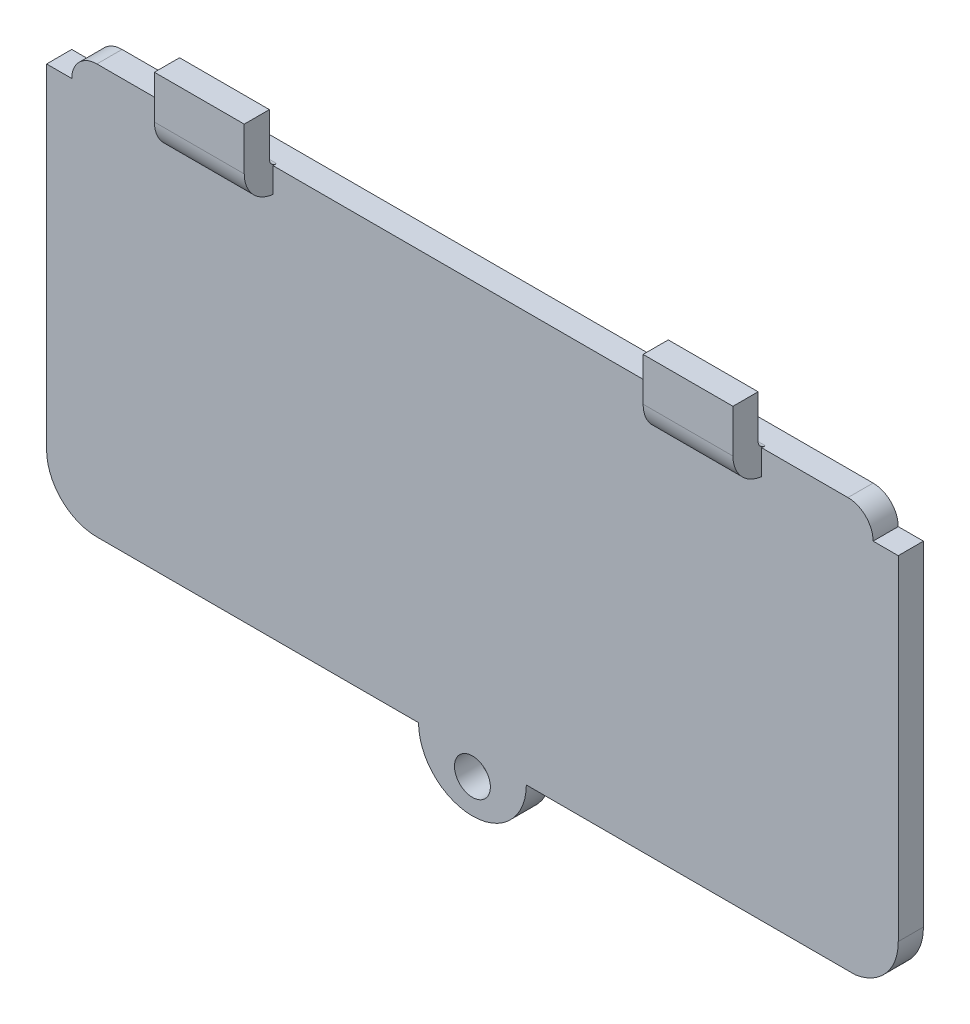
from build123d import *

# Parameters (mm, degrees)
BOSS_EXTRUDE1_DEPTH = 1.778
SKETCH3_R           = 1.27
CUT_EXTRUDE1_DEPTH  = 1.778
BOSS_EXTRUDE2_DEPTH = 40.894
SKETCH8_W           = 28.194
SKETCH8_H           = 3.556
CUT_EXTRUDE3_DEPTH  = 3.175
SKETCH10_W          = 28.194
SKETCH10_H          = 1.974840954
CUT_EXTRUDE4_DEPTH  = 31.75


with BuildPart() as part:
    # Sketch1 → Boss-Extrude1 (new body)
    with BuildSketch(Plane.XY):
        with BuildLine():
            Line((-30.353, 12.065), (-30.353, -11.557))
            ThreePointArc((-30.353, -11.557), (-29.311471714, -14.071471714), (-26.797, -15.113))
            Line((-26.797, -15.113), (-4.064, -15.113))
            ThreePointArc((-4.064, -15.113), (-0.254, -18.923), (3.556, -15.113))
            Line((3.556, -15.113), (26.797, -15.113))
            ThreePointArc((26.797, -15.113), (28.989103251, -13.90765993), (29.845, -11.557))
            Line((29.845, -11.557), (29.845, 12.065))
            Line((29.845, 12.065), (28.067, 12.065))
            ThreePointArc((28.067, 12.065), (27.546235857, 13.322235857), (26.289, 13.843))
            Line((26.289, 13.843), (-26.797, 13.843))
            ThreePointArc((-26.797, 13.843), (-28.054235857, 13.322235857), (-28.575, 12.065))
            Line((-28.575, 12.065), (-30.353, 12.065))
        make_face()
    extrude(amount=BOSS_EXTRUDE1_DEPTH)

    # Sketch3 → Cut-Extrude1 (cut)
    with BuildSketch(Plane(origin=(0, 0, 0), x_dir=(-1, 0, 0), z_dir=(0, 0, -1))):
        with Locations((0.254, -16.51)):
            Circle(SKETCH3_R)
    extrude(amount=-CUT_EXTRUDE1_DEPTH, mode=Mode.SUBTRACT)

    # Sketch7 → Boss-Extrude2 (add)
    with BuildSketch(Plane.ZY.offset(20.701)):
        with BuildLine():
            Line((2.032, 14.351), (2.032, 17.399))
            Line((2.032, 17.399), (3.81, 17.399))
            Line((3.81, 17.399), (3.81, 14.351))
            ThreePointArc((3.81, 14.351), (3.140446102, 12.734553898), (1.524, 12.065))
            Line((1.524, 12.065), (1.524, 13.843))
            ThreePointArc((1.524, 13.843), (1.883210245, 13.991789755), (2.032, 14.351))
        make_face()
    extrude(amount=-BOSS_EXTRUDE2_DEPTH)

    # Sketch8 → Cut-Extrude3 (cut, symmetric)
    with BuildSketch(Plane.XY.offset(1.778)):
        with Locations((-0.254, 15.621)):
            Rectangle(SKETCH8_W, SKETCH8_H)
    extrude(amount=CUT_EXTRUDE3_DEPTH, both=True, mode=Mode.SUBTRACT)

    # Sketch10 → Cut-Extrude4 (cut)
    with BuildSketch(Plane.XZ.offset(15.113)):
        with Locations((-0.254, 2.765420477)):
            Rectangle(SKETCH10_W, SKETCH10_H)
    extrude(amount=-CUT_EXTRUDE4_DEPTH, mode=Mode.SUBTRACT)


solid = part.part
